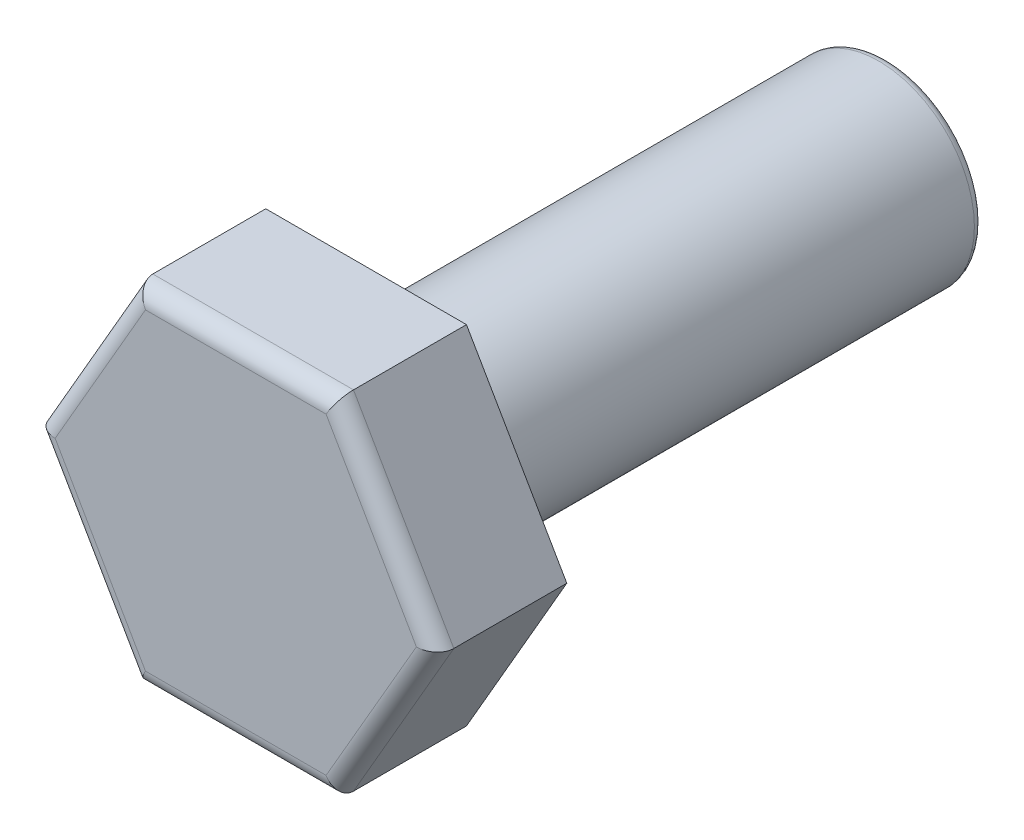
from build123d import *

# Parameters (mm, degrees)
SKETCH_1_R      = 11
EXTRUDE_1_DEPTH = 75
EXTRUDE_2_DEPTH = 15
FILLET_1_R      = 2
FILLET_2_R      = 1


with BuildPart() as part:
    # 草图1 → 凸台-拉伸1 (new body)
    with BuildSketch(Plane.XY):
        Circle(SKETCH_1_R)
    extrude(amount=EXTRUDE_1_DEPTH)

    # 草图3 → 凸台-拉伸2 (add)
    with BuildSketch(Plane.XY.offset(75)):
        Polygon((11.547005384, -20), (23.094010768, 0), (11.547005384, 20), (-11.547005384, 20), (-23.094010768, 0), (-11.547005384, -20), align=None)
    extrude(amount=-EXTRUDE_2_DEPTH)

    # 圆角1
    fillet_1_edges = [part.edges().sort_by_distance(p)[0] for p in [
        (0, -20, 75),
        (17.320508076, -10, 75),
        (17.320508076, 10, 75),
        (0, 20, 75),
        (-17.320508076, 10, 75),
        (-17.320508076, -10, 75),
    ]]
    fillet(fillet_1_edges, radius=FILLET_1_R)

    # 圆角2
    fillet_2_edges = [part.edges().sort_by_distance(p)[0] for p in [
        (-11, 0, 0),
    ]]
    fillet(fillet_2_edges, radius=FILLET_2_R)


solid = part.part
